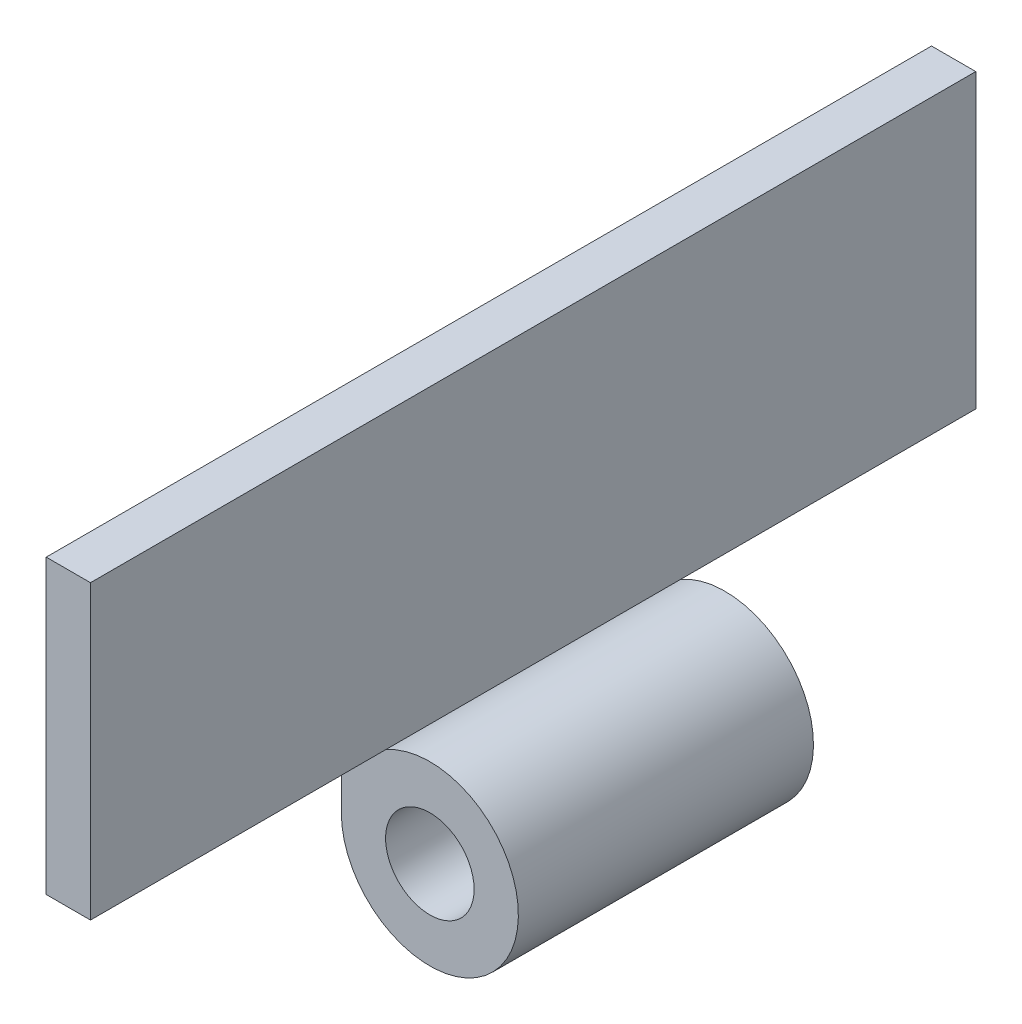
from build123d import *

# Parameters (mm, degrees)
BOSS_EXTRUDE1_DEPTH      = 30
BOSS_EXTRUDE1_DEPTH_BACK = 30
SKETCH1_R                = 3
CUT_EXTRUDE1_START       = -20
CUT_EXTRUDE1_DEPTH       = 20


with BuildPart() as part:
    # Sketch1 → Boss-Extrude1 (new, two sides: drawn at the far end of the back side and taken through both)
    with BuildSketch(Plane.XY.offset(-BOSS_EXTRUDE1_DEPTH_BACK)):
        with BuildLine():
            Line((-6, 0), (-6, 25))
            Line((-6, 25), (-3, 25))
            Line((-3, 25), (-3, 5.196152423))
            ThreePointArc((-3, 5.196152423), (5.196152423, -3), (-6, 0))
        make_face()
        Circle(SKETCH1_R, mode=Mode.SUBTRACT)
    extrude(amount=BOSS_EXTRUDE1_DEPTH + BOSS_EXTRUDE1_DEPTH_BACK)

    # Sketch2 → Cut-Extrude1 (cut)
    with BuildSketch(Plane.XY.offset(30).offset(CUT_EXTRUDE1_START)):
        with BuildLine():
            Line((-3, 5.196152423), (-6, 5.196152423))
            Line((-6, 5.196152423), (-6, 0))
            ThreePointArc((-6, 0), (5.196152423, -3), (-3, 5.196152423))
        make_face()
    cut_extrude1 = extrude(amount=CUT_EXTRUDE1_DEPTH, mode=Mode.SUBTRACT)

    # Mirror1: Cut-Extrude1 across plane
    add(cut_extrude1.mirror(Plane.XY), mode=Mode.SUBTRACT)


solid = part.part
